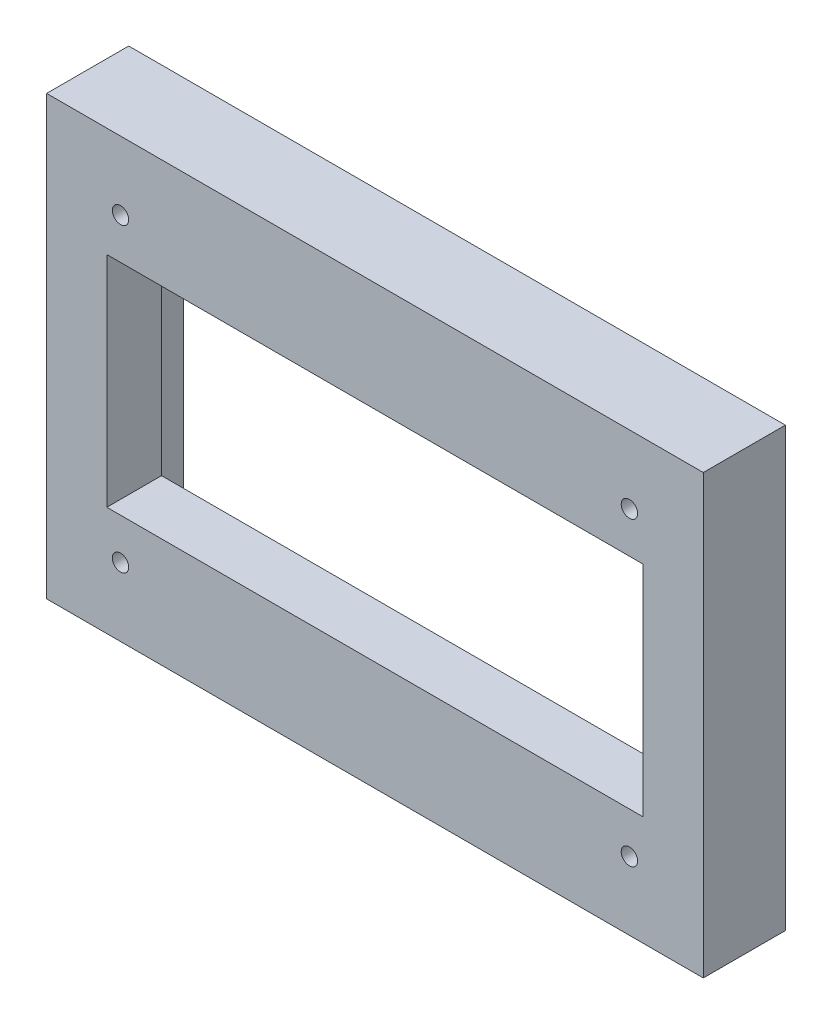
from build123d import *

# Parameters (mm, degrees)
SKETCH1_W           = 120
SKETCH1_H           = 80
BOSS_EXTRUDE1_DEPTH = 10
SKETCH2_W           = 98
SKETCH2_H           = 40
CUT_EXTRUDE2_DEPTH  = 15
SKETCH4_R           = 1.5
CUT_EXTRUDE3_DEPTH  = 15
SKETCH5_W           = 120
SKETCH5_H           = 80
BOSS_EXTRUDE2_DEPTH = 5
SKETCH6_W           = 100
SKETCH6_H           = 60
CUT_EXTRUDE5_DEPTH  = 5


with BuildPart() as part:
    # Sketch1 → Boss-Extrude1 (new body)
    with BuildSketch(Plane.XY):
        Rectangle(SKETCH1_W, SKETCH1_H)
    extrude(amount=-BOSS_EXTRUDE1_DEPTH)

    # Sketch2 → Cut-Extrude2 (cut)
    with BuildSketch(Plane(origin=(0, 0, -10), x_dir=(-1, 0, 0), z_dir=(0, 0, -1))):
        Rectangle(SKETCH2_W, SKETCH2_H)
    extrude(amount=-CUT_EXTRUDE2_DEPTH, mode=Mode.SUBTRACT)

    # Sketch4 → Cut-Extrude3 (cut)
    with BuildSketch(Plane.XY):
        with Locations((-46.5, 27.5)):
            Circle(SKETCH4_R)
        with Locations((46.5, 27.5)):
            Circle(SKETCH4_R)
        with Locations((46.5, -27.5)):
            Circle(SKETCH4_R)
        with Locations((-46.5, -27.5)):
            Circle(SKETCH4_R)
    extrude(amount=-CUT_EXTRUDE3_DEPTH, mode=Mode.SUBTRACT)

    # Sketch5 → Boss-Extrude2 (add)
    with BuildSketch(Plane(origin=(0, 0, -10), x_dir=(-1, 0, 0), z_dir=(0, 0, -1))):
        Rectangle(SKETCH5_W, SKETCH5_H)
    extrude(amount=BOSS_EXTRUDE2_DEPTH)

    # Sketch6 → Cut-Extrude5 (cut)
    with BuildSketch(Plane(origin=(0, 0, -15), x_dir=(-1, 0, 0), z_dir=(0, 0, -1))):
        Rectangle(SKETCH6_W, SKETCH6_H)
    extrude(amount=-CUT_EXTRUDE5_DEPTH, mode=Mode.SUBTRACT)


solid = part.part
